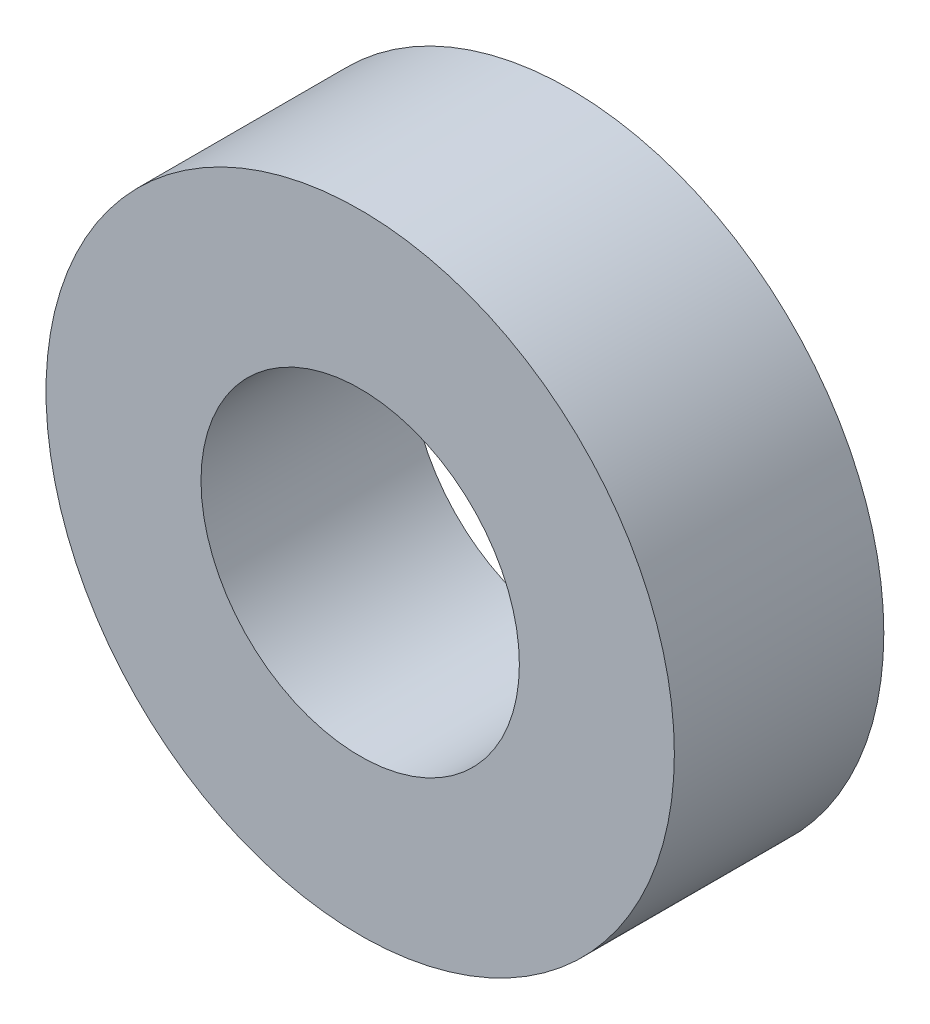
from build123d import *

# Parameters (mm, degrees)
SKETCH1_R      = 9.525
SKETCH1_R_2    = 4.826
EXTRUDE1_DEPTH = 3.175


with BuildPart() as part:
    # Sketch1 → Extrude1 (new, symmetric)
    with BuildSketch(Plane.XY):
        Circle(SKETCH1_R)
        Circle(SKETCH1_R_2, mode=Mode.SUBTRACT)
    extrude(amount=EXTRUDE1_DEPTH, both=True)


solid = part.part
